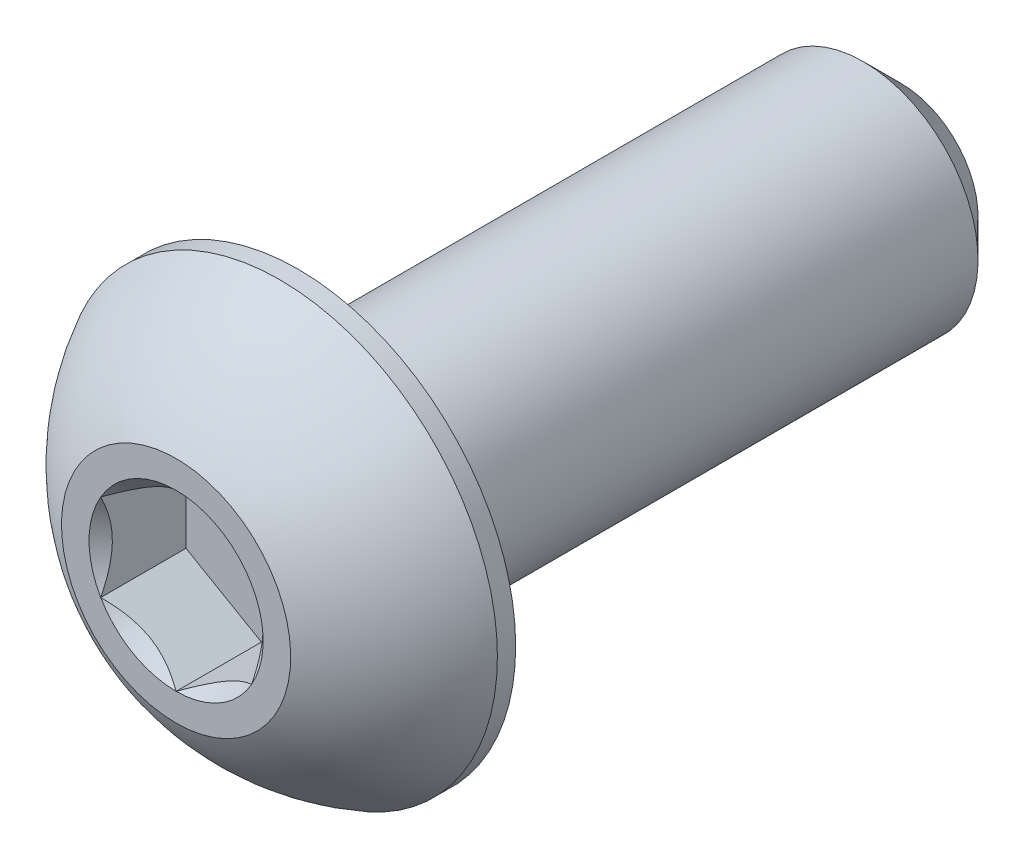
from build123d import *

# Parameters (mm, degrees)
SKETCH1_W          = 12.7
SKETCH1_H          = 2.413
CHAMFER1_SIZE      = 0.79375
CUT_EXTRUDE2_DEPTH = 1.79578
SKETCH6_R          = 1.833087105
CUT_EXTRUDE3_DEPTH = 1.79578
CUT_EXTRUDE3_TAPER = 45


with BuildPart() as part:
    # Sketch1 → Revolve1 (revolve)
    with BuildSketch(Plane(origin=(0, 0, 0), x_dir=(0, 0, -1), z_dir=(1, 0, 0))):
        with Locations((8.9154, 1.2065)):
            Rectangle(SKETCH1_W, SKETCH1_H)
    revolve(axis=Axis((0, 0, -15.2654), (0, 0, 1)))

    # Chamfer1
    chamfer1_edges = [part.edges().sort_by_distance(p)[0] for p in [
        (0, -2.413, -15.2654),
    ]]
    chamfer(chamfer1_edges, length=CHAMFER1_SIZE)

    # Sketch7 → Revolve2 (revolve)
    with BuildSketch(Plane(origin=(0, 0, 0), x_dir=(0, 0, -1), z_dir=(1, 0, 0)), mode=Mode.PRIVATE) as revolve2_sk:
        with BuildLine():
            Line((2.18059, 4.5847), (2.5654, 4.5847))
            Line((2.5654, 4.5847), (2.5654, 0))
            Line((2.5654, 0), (0, 0))
            Line((0, 0), (0, 2.413))
            ThreePointArc((0, 2.413), (0.925030326, 3.664791196), (2.18059, 4.5847))
        make_face()
    revolve(revolve2_sk.sketch.rotate(Axis((0, 0, 0), (0, 0, -1)), 180), axis=Axis((0, 0, 0), (0, 0, -1)))

    # Sketch5 → Cut-Extrude2 (cut)
    with BuildSketch(Plane.XY):
        Polygon((1.5875, -0.916543552), (1.5875, 0.916543552), (0, 1.833087105), (-1.5875, 0.916543552), (-1.5875, -0.916543552), (0, -1.833087105), align=None)
    extrude(amount=-CUT_EXTRUDE2_DEPTH, mode=Mode.SUBTRACT)

    # Sketch6 → Cut-Extrude3 (cut)
    with BuildSketch(Plane.XY):
        Circle(SKETCH6_R)
    extrude(amount=-CUT_EXTRUDE3_DEPTH, taper=CUT_EXTRUDE3_TAPER, mode=Mode.SUBTRACT)


solid = part.part
